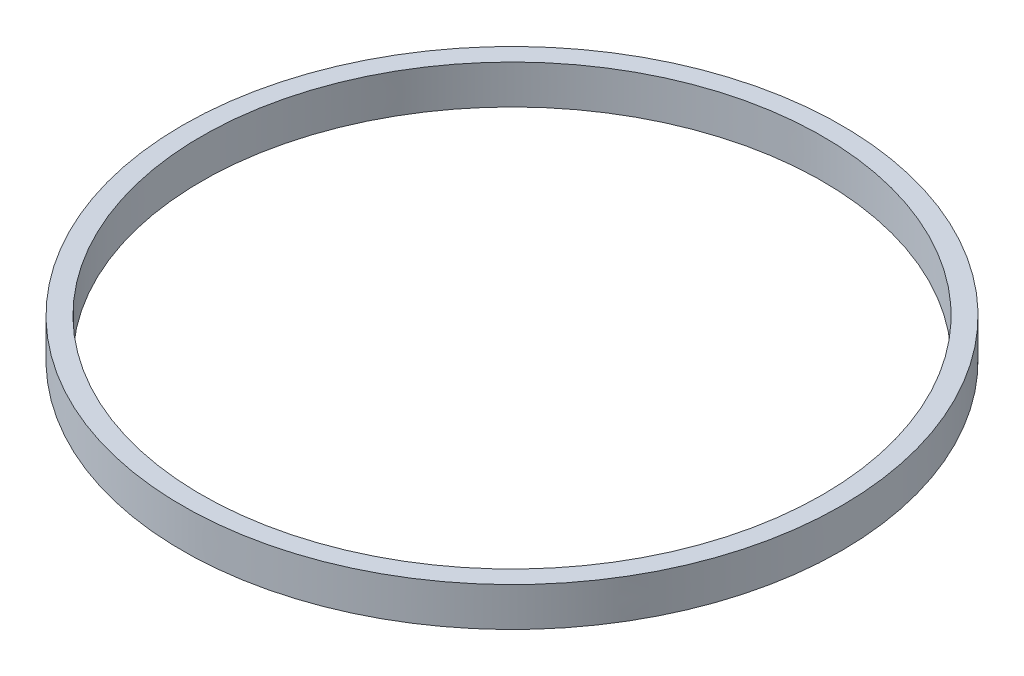
from build123d import *


with BuildPart() as part:
    # Çizim1 → Döndür1 (revolve)
    with BuildSketch(Plane.XY):
        Polygon((17.237213994, 0.000891396), (17.23701491, 2.037002968), (16.240927134, 2.036905574), (16.241126218, 0.000794001), align=None)
    revolve(axis=Axis((0, 0, 0), (-4.888832334972122e-05, 0.9999999988049659, 0)))


solid = part.part
